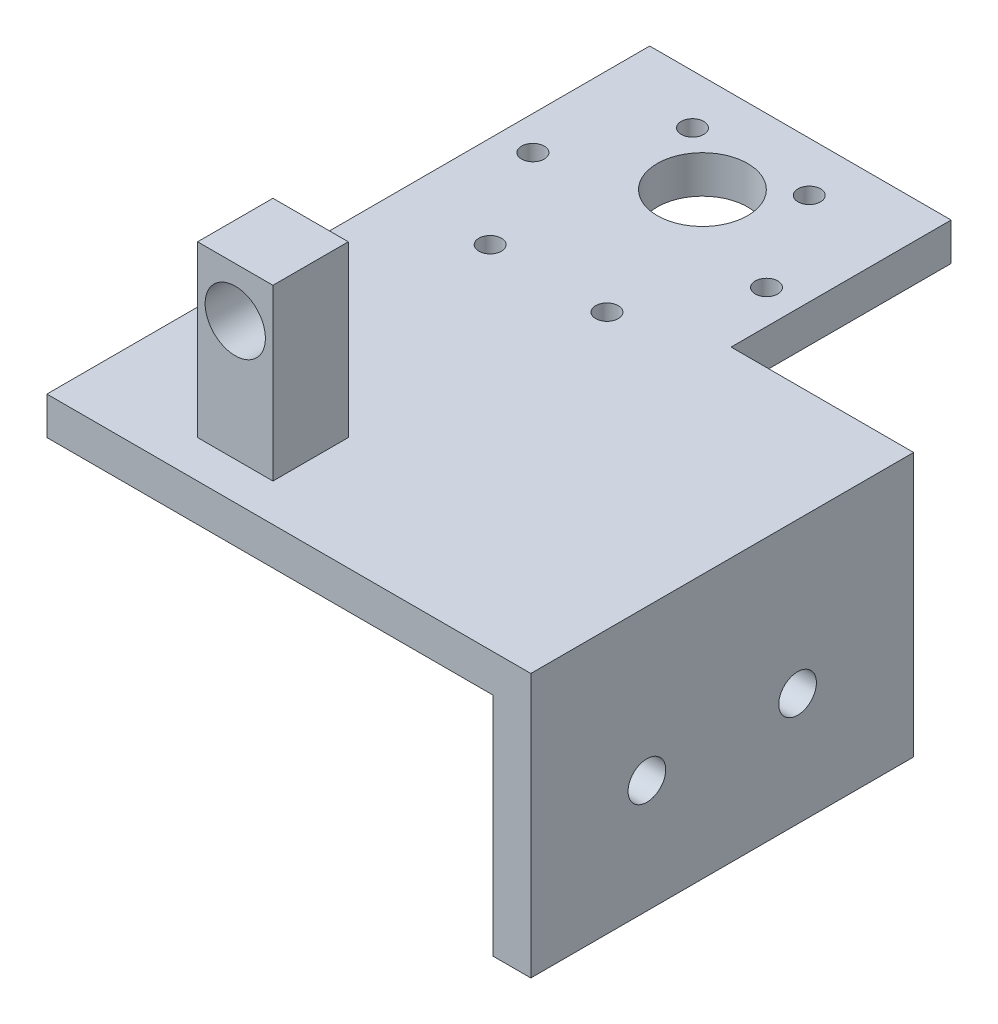
from build123d import *

# Parameters (mm, degrees)
SKETCH3_W           = 40
SKETCH3_H           = 80
BOSS_EXTRUDE1_DEPTH = 5
SKETCH1_R           = 1.5
SKETCH1_R_2         = 6
CUT_EXTRUDE3_DEPTH  = 64.442887702
SKETCH4_W           = 10
SKETCH4_H           = 10
BOSS_EXTRUDE2_DEPTH = 22.5
SKETCH5_R           = 4
CUT_EXTRUDE4_DEPTH  = 8
SKETCH6_W           = 50.8
SKETCH6_H           = 5
BOSS_EXTRUDE3_DEPTH = 24.225
SKETCH8_W           = 5
SKETCH8_H           = 50.8
BOSS_EXTRUDE4_DEPTH = 30
SKETCH9_R           = 2.5
CUT_EXTRUDE5_DEPTH  = 5


with BuildPart() as part:
    # Sketch3 → Boss-Extrude1 (new body)
    with BuildSketch(Plane(origin=(0, 0, 0), x_dir=(1, 0, 0), z_dir=(0, 1, 0))):
        with Locations((0, -20)):
            Rectangle(SKETCH3_W, SKETCH3_H)
    extrude(amount=BOSS_EXTRUDE1_DEPTH)

    # Sketch1 → Cut-Extrude3 (cut, through all)
    with BuildSketch(Plane(origin=(0, 0, 0), x_dir=(1, 0, 0), z_dir=(0, 1, 0))):
        with Locations(Location((-15.5, 0, 0), (0, 0, 270))):
            Circle(SKETCH1_R)
        with Locations(Location((-7.75, 13.423393759, 0), (0, 0, 270))):
            Circle(SKETCH1_R)
        with Locations(Location((7.75, 13.423393759, 0), (0, 0, 270))):
            Circle(SKETCH1_R)
        with Locations(Location((15.5, 0, 0), (0, 0, 270))):
            Circle(SKETCH1_R)
        with Locations(Location((7.75, -13.423393759, 0), (0, 0, 270))):
            Circle(SKETCH1_R)
        with Locations(Location((-7.75, -13.423393759, 0), (0, 0, 270))):
            Circle(SKETCH1_R)
        with Locations(Location((0, 7, 0), (0, 0, 270))):
            Circle(SKETCH1_R_2)
    extrude(amount=CUT_EXTRUDE3_DEPTH, mode=Mode.SUBTRACT)

    # Sketch4 → Boss-Extrude2 (add)
    with BuildSketch(Plane(origin=(0, 5, 0), x_dir=(1, 0, 0), z_dir=(0, 1, 0))):
        with Locations((0, -50)):
            Rectangle(SKETCH4_W, SKETCH4_H)
    extrude(amount=BOSS_EXTRUDE2_DEPTH)

    # Sketch5 → Cut-Extrude4 (cut)
    with BuildSketch(Plane.XY.offset(55)):
        with Locations((0, 20.9)):
            Circle(SKETCH5_R)
    extrude(amount=-CUT_EXTRUDE4_DEPTH, mode=Mode.SUBTRACT)

    # Sketch6 → Boss-Extrude3 (add)
    with BuildSketch(Plane(origin=(20, 0, 0), x_dir=(0, 0, -1), z_dir=(1, 0, 0))):
        with Locations((-34.6, 2.5)):
            Rectangle(SKETCH6_W, SKETCH6_H)
    extrude(amount=BOSS_EXTRUDE3_DEPTH)

    # Sketch8 → Boss-Extrude4 (add)
    with BuildSketch(Plane.XZ):
        with Locations((41.725, 34.6)):
            Rectangle(SKETCH8_W, SKETCH8_H)
    extrude(amount=BOSS_EXTRUDE4_DEPTH)

    # Sketch9 → Cut-Extrude5 (cut)
    with BuildSketch(Plane(origin=(44.225, 0, 0), x_dir=(0, 0, -1), z_dir=(1, 0, 0))):
        with Locations((-44.6, -15)):
            Circle(SKETCH9_R)
        with Locations((-24.6, -15)):
            Circle(SKETCH9_R)
    extrude(amount=-CUT_EXTRUDE5_DEPTH, mode=Mode.SUBTRACT)


solid = part.part
